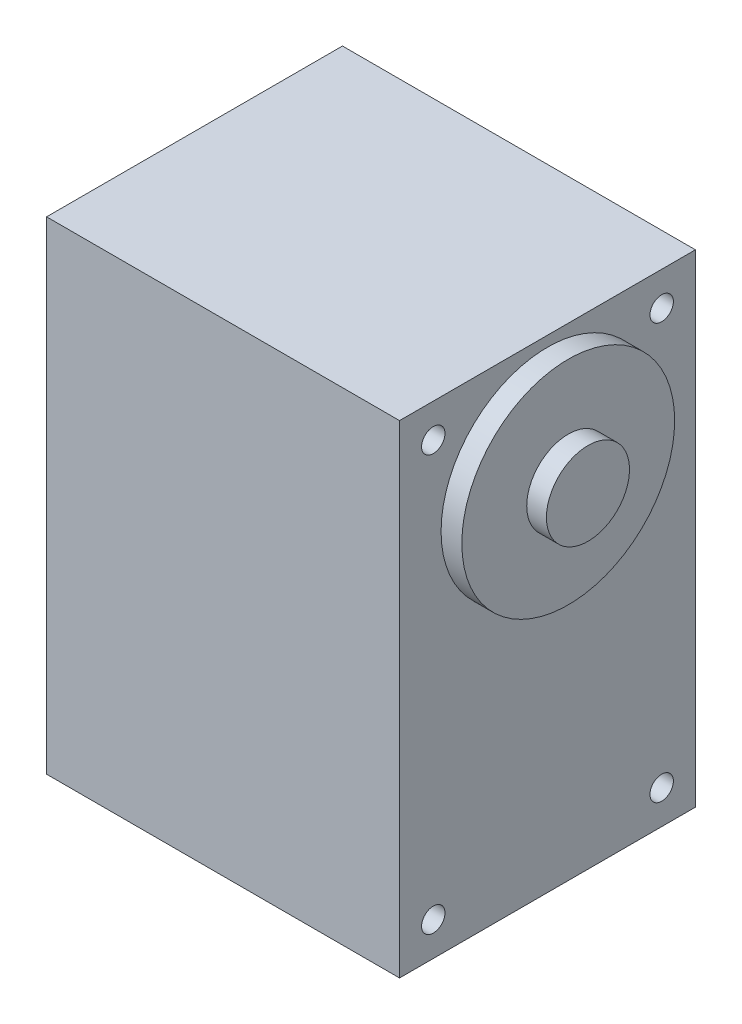
from build123d import *

# Parameters (mm, degrees)
SKETCH1_W           = 34
SKETCH1_H           = 46.5
BOSS_EXTRUDE1_DEPTH = 28.5
SKETCH2_R           = 10.25
BOSS_EXTRUDE2_DEPTH = 2
SKETCH3_R           = 4
BOSS_EXTRUDE3_DEPTH = 1.9
SKETCH10_R          = 1.126890163
CUT_EXTRUDE2_DEPTH  = 4


with BuildPart() as part:
    # Sketch1 → Boss-Extrude1 (new body)
    with BuildSketch(Plane.XY):
        Rectangle(SKETCH1_W, SKETCH1_H)
    extrude(amount=BOSS_EXTRUDE1_DEPTH)

    # Sketch2 → Boss-Extrude2 (add)
    with BuildSketch(Plane(origin=(17, 0, 0), x_dir=(0, 0, -1), z_dir=(1, 0, 0))):
        with Locations((-14.25, 12)):
            Circle(SKETCH2_R)
    extrude(amount=BOSS_EXTRUDE2_DEPTH)

    # Sketch3 → Boss-Extrude3 (add)
    with BuildSketch(Plane(origin=(19, 0, 0), x_dir=(0, 0, -1), z_dir=(1, 0, 0))):
        with Locations(Location((-14.25, 12, 0), (0, 0, 180))):
            Circle(SKETCH3_R)
    extrude(amount=BOSS_EXTRUDE3_DEPTH)

    # Sketch10 → Cut-Extrude2 (cut)
    with BuildSketch(Plane(origin=(17, 0, 0), x_dir=(0, 0, -1), z_dir=(1, 0, 0))):
        with Locations((-3.25, 20)):
            Circle(SKETCH10_R)
        with Locations((-25.25, 20)):
            Circle(SKETCH10_R)
        with Locations((-25.25, -20)):
            Circle(SKETCH10_R)
        with Locations((-3.25, -20)):
            Circle(SKETCH10_R)
    cut_extrude2 = extrude(amount=-CUT_EXTRUDE2_DEPTH, mode=Mode.SUBTRACT)

    # Mirror1: Cut-Extrude2 across plane
    add(cut_extrude2.mirror(Plane(origin=(0, 0, 0), x_dir=(0, 0, 1), z_dir=(1, 0, 0))), mode=Mode.SUBTRACT)


solid = part.part
